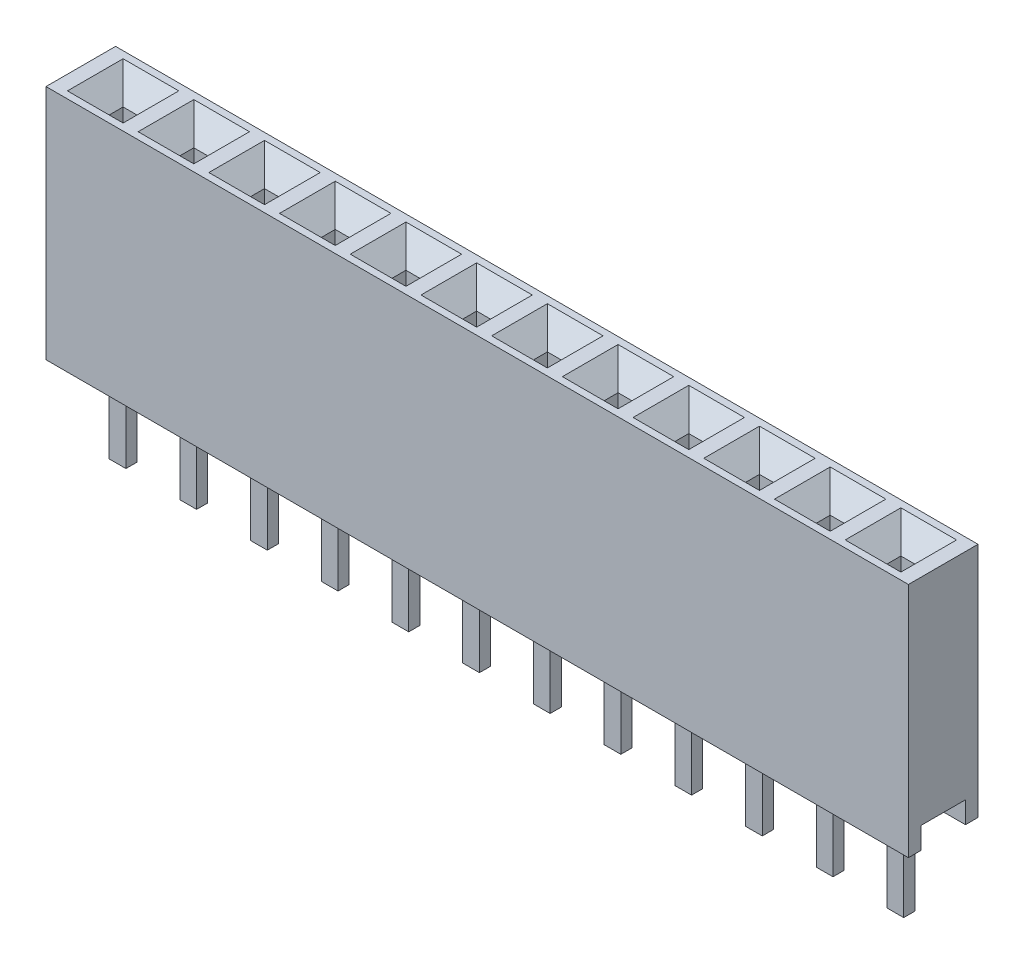
from build123d import *

# Parameters (mm, degrees)
SKETCH_1_W                         = 30.98
SKETCH_1_H                         = 2.5
EXTRUDE_1_DEPTH                    = 8.5
SKETCH_2_W                         = 0.5
SKETCH_2_H                         = 0.5
CUT_EXTRUDE_1_DEPTH                = 7.5
CHAMFER_1_SIZE                     = 0.75
SKETCH_6_W                         = 0.5
SKETCH_6_H                         = 0.5
CUT_EXTRUDE_3_DEPTH                = 7.5
CHAMFER_3_SIZE                     = 0.75
CUT_EXTRUDE_2_REACH                = 34.149
SKETCH_4_W                         = 1.6
SKETCH_4_H                         = 0.776369944
PATTERN_LINEAR_1_COUNT             = 6
PATTERN_LINEAR_1_PITCH             = 2.54
CHAMFER_3_OF_PATTERN_LINEAR_1_SIZE = 0.75
PATTERN_LINEAR_2_COUNT             = 6
PATTERN_LINEAR_2_PITCH             = 2.54
CHAMFER_1_OF_PATTERN_LINEAR_2_SIZE = 0.75
SKETCH_7_W                         = 0.6
SKETCH_7_H                         = 0.4
EXTRUDE_4_DEPTH                    = 3.776369944
SKETCH_8_W                         = 0.6
SKETCH_8_H                         = 0.4
EXTRUDE_5_DEPTH                    = 3.776369944
PATTERN_LINEAR_8_COUNT             = 6
PATTERN_LINEAR_8_PITCH             = 2.54
PATTERN_LINEAR_9_COUNT             = 6
PATTERN_LINEAR_9_PITCH             = 2.54


with BuildPart() as part:
    # Эскиз1 → Бобышка-Вытянуть1 (new body)
    with BuildSketch(Plane(origin=(0, 0, 0), x_dir=(1, 0, 0), z_dir=(0, 1, 0))):
        Rectangle(SKETCH_1_W, SKETCH_1_H)
    extrude(amount=EXTRUDE_1_DEPTH)

    # Эскиз2 → Вырез-Вытянуть1 (cut)
    with BuildSketch(Plane(origin=(0, 8.5, 0), x_dir=(1, 0, 0), z_dir=(0, 1, 0))):
        with Locations((1.27, 0)):
            Rectangle(SKETCH_2_W, SKETCH_2_H)
    cut_extrude_1 = extrude(amount=-CUT_EXTRUDE_1_DEPTH, mode=Mode.SUBTRACT)

    # Фаска1
    chamfer_1_edges = [part.edges().sort_by_distance(p)[0] for p in [
        (1.52, 8.5, 0),
        (1.27, 8.5, -0.25),
        (1.02, 8.5, 0),
        (1.27, 8.5, 0.25),
    ]]
    chamfer(chamfer_1_edges, length=CHAMFER_1_SIZE)

    # Эскиз6 → Вырез-Вытянуть3 (cut)
    with BuildSketch(Plane(origin=(0, 8.5, 0), x_dir=(1, 0, 0), z_dir=(0, 1, 0))):
        with Locations((-1.27, 0)):
            Rectangle(SKETCH_6_W, SKETCH_6_H)
    cut_extrude_3 = extrude(amount=-CUT_EXTRUDE_3_DEPTH, mode=Mode.SUBTRACT)

    # Фаска3
    chamfer_3_edges = [part.edges().sort_by_distance(p)[0] for p in [
        (-1.02, 8.5, 0),
        (-1.27, 8.5, -0.25),
        (-1.52, 8.5, 0),
        (-1.27, 8.5, 0.25),
    ]]
    chamfer(chamfer_3_edges, length=CHAMFER_3_SIZE)

    # Эскиз4 → Вырез-Вытянуть2 (cut, up to next)
    with BuildSketch(Plane(origin=(15.49, 0, 0), x_dir=(0, 0, -1), z_dir=(1, 0, 0)), mode=Mode.PRIVATE) as cut_extrude_2_sk1:
        with Locations((0, 0.388184972)):
            Rectangle(SKETCH_4_W, SKETCH_4_H)
    cut_extrude_2_tool1 = extrude(cut_extrude_2_sk1.sketch, amount=-CUT_EXTRUDE_2_REACH, mode=Mode.PRIVATE) & part.part
    add(cut_extrude_2_tool1.solids().sort_by_distance((15.49, 0.388185, 0))[0], mode=Mode.SUBTRACT)

    # Линейный массив1: Вырез-Вытянуть3 ×6
    with Locations(*[(-i * PATTERN_LINEAR_1_PITCH, 0, 0) for i in range(1, PATTERN_LINEAR_1_COUNT)]):
        add(cut_extrude_3, mode=Mode.SUBTRACT)

    # Фаска3 of Линейный массив1
    chamfer_3_of_pattern_linear_1_edges = [part.edges().sort_by_distance(p)[0] for p in [
        (-3.56, 8.5, 0),
        (-3.81, 8.5, -0.25),
        (-4.06, 8.5, 0),
        (-3.81, 8.5, 0.25),
        (-6.1, 8.5, 0),
        (-6.35, 8.5, -0.25),
        (-6.6, 8.5, 0),
        (-6.35, 8.5, 0.25),
        (-8.64, 8.5, 0),
        (-8.89, 8.5, -0.25),
        (-9.14, 8.5, 0),
        (-8.89, 8.5, 0.25),
        (-11.18, 8.5, 0),
        (-11.43, 8.5, -0.25),
        (-11.68, 8.5, 0),
        (-11.43, 8.5, 0.25),
        (-13.72, 8.5, 0),
        (-13.97, 8.5, -0.25),
        (-14.22, 8.5, 0),
        (-13.97, 8.5, 0.25),
    ]]
    chamfer(chamfer_3_of_pattern_linear_1_edges, length=CHAMFER_3_OF_PATTERN_LINEAR_1_SIZE)

    # Линейный массив2: Вырез-Вытянуть1 ×6
    with Locations(*[(i * PATTERN_LINEAR_2_PITCH, 0, 0) for i in range(1, PATTERN_LINEAR_2_COUNT)]):
        add(cut_extrude_1, mode=Mode.SUBTRACT)

    # Фаска1 of Линейный массив2
    chamfer_1_of_pattern_linear_2_edges = [part.edges().sort_by_distance(p)[0] for p in [
        (4.06, 8.5, 0),
        (3.81, 8.5, -0.25),
        (3.56, 8.5, 0),
        (3.81, 8.5, 0.25),
        (6.6, 8.5, 0),
        (6.35, 8.5, -0.25),
        (6.1, 8.5, 0),
        (6.35, 8.5, 0.25),
        (9.14, 8.5, 0),
        (8.89, 8.5, -0.25),
        (8.64, 8.5, 0),
        (8.89, 8.5, 0.25),
        (11.68, 8.5, 0),
        (11.43, 8.5, -0.25),
        (11.18, 8.5, 0),
        (11.43, 8.5, 0.25),
        (14.22, 8.5, 0),
        (13.97, 8.5, -0.25),
        (13.72, 8.5, 0),
        (13.97, 8.5, 0.25),
    ]]
    chamfer(chamfer_1_of_pattern_linear_2_edges, length=CHAMFER_1_OF_PATTERN_LINEAR_2_SIZE)


with BuildPart() as body_2:
    # Эскиз7 → Бобышка-Вытянуть4 (new body)
    with BuildSketch(Plane.XZ.offset(-0.776369944)):
        with Locations((-1.27, 0)):
            Rectangle(SKETCH_7_W, SKETCH_7_H)
    extrude_4 = extrude(amount=EXTRUDE_4_DEPTH)


with BuildPart() as body_3:
    # Эскиз8 → Бобышка-Вытянуть5 (new body)
    with BuildSketch(Plane.XZ.offset(-0.776369944)):
        with Locations((1.27, 0)):
            Rectangle(SKETCH_8_W, SKETCH_8_H)
    extrude_5 = extrude(amount=EXTRUDE_5_DEPTH)


with BuildPart() as pattern_linear_8_1:
    # Линейный массив8: Бобышка-Вытянуть5 ×6
    with Locations(*[(i * PATTERN_LINEAR_8_PITCH, 0, 0) for i in range(1, PATTERN_LINEAR_8_COUNT)]):
        add(extrude_5)


with BuildPart() as pattern_linear_9_1:
    # Линейный массив9: Бобышка-Вытянуть4 ×6
    with Locations(*[(-i * PATTERN_LINEAR_9_PITCH, 0, 0) for i in range(1, PATTERN_LINEAR_9_COUNT)]):
        add(extrude_4)


solid = Compound([part.part, body_2.part, body_3.part, pattern_linear_8_1.part, pattern_linear_9_1.part])
